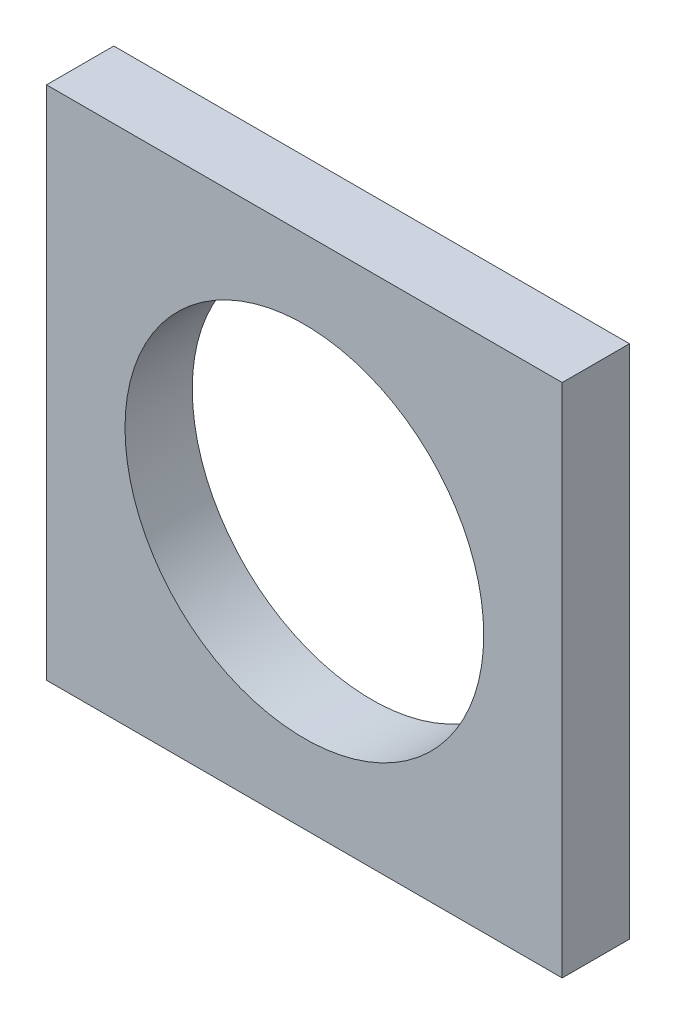
from build123d import *

# Parameters (mm, degrees)
SKETCH_1_W      = 23
SKETCH_1_H      = 23
SKETCH_1_R      = 8
EXTRUDE_1_DEPTH = 3


with BuildPart() as part:
    # 草图1 → 凸台-拉伸1 (new body)
    with BuildSketch(Plane.XY):
        Rectangle(SKETCH_1_W, SKETCH_1_H)
        Circle(SKETCH_1_R, mode=Mode.SUBTRACT)
    extrude(amount=EXTRUDE_1_DEPTH)


solid = part.part
